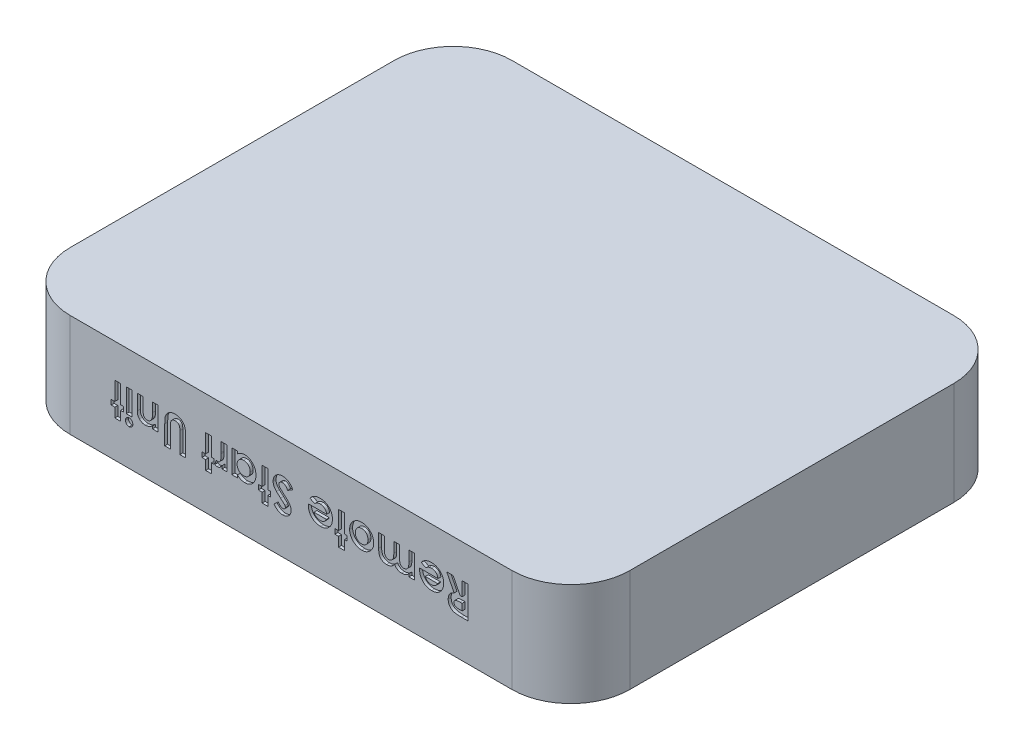
from build123d import *

# Parameters (mm, degrees)
SKETCH1_W           = 120.65
SKETCH1_H           = 95.25
SKETCH1_W_2         = 114.3
SKETCH1_H_2         = 88.9
BOSS_EXTRUDE1_DEPTH = 19.05
FILLET1_R           = 12.7
BOSS_EXTRUDE2_START = 3.175
BOSS_EXTRUDE2_DEPTH = 3.175
CUT_EXTRUDE1_DEPTH  = 113.298093817
FILLET2_R           = 6.35
SKETCH4_W           = 1.234722222
SKETCH4_H           = 5.027083333
CUT_EXTRUDE2_DEPTH  = 0.635


with BuildPart() as part:
    # Sketch1 → Boss-Extrude1 (new body)
    with BuildSketch(Plane(origin=(0, 0, 0), x_dir=(1, 0, 0), z_dir=(0, 1, 0))):
        Rectangle(SKETCH1_W, SKETCH1_H)
        Rectangle(SKETCH1_W_2, SKETCH1_H_2, mode=Mode.SUBTRACT)
    extrude(amount=BOSS_EXTRUDE1_DEPTH)

    # Fillet1
    fillet1_edges = [part.edges().sort_by_distance(p)[0] for p in [
        (57.15, 9.525, 44.45),
        (57.15, 9.525, -44.45),
        (-57.15, 9.525, -44.45),
        (-57.15, 9.525, 44.45),
        (-60.325, 9.525, -47.625),
        (60.325, 9.525, -47.625),
        (60.325, 9.525, 47.625),
        (-60.325, 9.525, 47.625),
    ]]
    fillet(fillet1_edges, radius=FILLET1_R)

    # Sketch2 → Boss-Extrude2 (add)
    with BuildSketch(Plane(origin=(0, 19.05, 0), x_dir=(1, 0, 0), z_dir=(0, 1, 0)).offset(BOSS_EXTRUDE2_START)):
        with BuildLine():
            Line((60.325, -34.925), (60.325, 34.925))
            ThreePointArc((60.325, 34.925), (56.605256121, 43.905256121), (47.625, 47.625))
            Line((47.625, 47.625), (-47.625, 47.625))
            ThreePointArc((-47.625, 47.625), (-56.605256121, 43.905256121), (-60.325, 34.925))
            Line((-60.325, 34.925), (-60.325, -34.925))
            ThreePointArc((-60.325, -34.925), (-56.605256121, -43.905256121), (-47.625, -47.625))
            Line((-47.625, -47.625), (47.625, -47.625))
            ThreePointArc((47.625, -47.625), (56.605256121, -43.905256121), (60.325, -34.925))
        make_face()
    extrude(amount=-BOSS_EXTRUDE2_DEPTH)

    # Sketch3 → Cut-Extrude1 (cut, through all)
    with BuildSketch(Plane.XY.offset(-44.45)):
        with BuildLine():
            Line((-2.54, -16.51), (-2.54, 16.51))
            ThreePointArc((-2.54, 16.51), (0, 19.05), (2.54, 16.51))
            Line((2.54, 16.51), (2.54, -16.51))
            ThreePointArc((2.54, -16.51), (0, -19.05), (-2.54, -16.51))
        make_face()
    extrude(amount=-CUT_EXTRUDE1_DEPTH, mode=Mode.SUBTRACT)

    # Fillet2
    fillet2_edges = [part.edges().sort_by_distance(p)[0] for p in [
        (-2.54, 0, -46.0375),
        (2.54, 0, -46.0375),
    ]]
    fillet(fillet2_edges, radius=FILLET2_R)

    # Sketch4 → Cut-Extrude2 (cut)
    # profile 1 of 16: a face of its own
    with BuildSketch(Plane.XY.offset(47.625)):
        Polygon((-36.777083333, 7.890951399), (-38.011805556, 7.890951399), (-38.011805556, 9.919423622), (-38.805555556, 9.919423622), (-38.805555556, 10.977756955), (-38.011805556, 10.977756955), (-38.011805556, 14.946506955), (-36.777083333, 14.946506955), (-36.777083333, 10.977756955), (-36.159722222, 10.977756955), (-36.159722222, 9.919423622), (-36.777083333, 9.919423622), align=None)
    # profile 2 of 16: a face of its own
    with BuildSketch(Plane.XY.offset(47.625)):
        with BuildLine():
            add(Edge.make_bspline(
                [(-34.922243924, 7.802756955), (-34.975479478, 7.805335871), (-35.080012618, 7.81039982), (-35.229226491, 7.860764578), (-35.36751553, 7.937242076), (-35.488259897, 8.045355514), (-35.590421274, 8.17343635), (-35.664276907, 8.319290714), (-35.71033141, 8.477998549), (-35.715904693, 8.588383751), (-35.71875, 8.644738292)],
                knots=[0, 0, 0, 0, 0.989651449, 1.943275965, 2.90597644, 3.919767043, 4.944608933, 5.944551278, 6.950639519, 8, 8, 8, 8], degree=3))
            add(Edge.make_bspline(
                [(-35.71875, 8.644738292), (-35.715725574, 8.700575394), (-35.709808354, 8.80981942), (-35.66647354, 8.967524643), (-35.590972334, 9.110202004), (-35.491345204, 9.238118722), (-35.36965345, 9.342518295), (-35.235350098, 9.422961445), (-35.086979288, 9.470053613), (-34.984118732, 9.475623321), (-34.931890191, 9.478451399)],
                knots=[0, 0, 0, 0, 1.052725588, 2.059633778, 3.055596988, 4.079986438, 5.099674807, 6.062641398, 7.01628558, 8, 8, 8, 8], degree=3))
            add(Edge.make_bspline(
                [(-34.931890191, 9.478451399), (-34.878228145, 9.475817956), (-34.772860598, 9.470647086), (-34.621436224, 9.420938698), (-34.483097542, 9.341169408), (-34.361441947, 9.231842046), (-34.260401069, 9.10199027), (-34.18325688, 8.956721384), (-34.140151313, 8.79551784), (-34.134268404, 8.684027354), (-34.13125, 8.626823795)],
                knots=[0, 0, 0, 0, 0.989280592, 1.942491504, 2.912382296, 3.922750976, 4.94514089, 5.940052451, 6.943081751, 8, 8, 8, 8], degree=3))
            add(Edge.make_bspline(
                [(-34.13125, 8.626823795), (-34.134298918, 8.571897348), (-34.140288076, 8.464002273), (-34.183655306, 8.308229261), (-34.258778314, 8.166146111), (-34.360745569, 8.041487616), (-34.47967895, 7.934434131), (-34.617065731, 7.858948386), (-34.765664781, 7.810932092), (-34.869511958, 7.805510138), (-34.922243924, 7.802756955)],
                knots=[0, 0, 0, 0, 1.038763745, 2.040501419, 3.031928819, 4.058179968, 5.07455544, 6.03952971, 7.004503979, 8, 8, 8, 8], degree=3))
        make_face()
    # profile 3 of 16: a face of its own
    with BuildSketch(Plane.XY.offset(47.625)):
        with Locations((-34.925, 12.432965289)):
            Rectangle(SKETCH4_W, SKETCH4_H)
    # profile 4 of 16: a face of its own
    with BuildSketch(Plane.XY.offset(47.625)):
        with BuildLine():
            Line((-28.663194444, 9.919423622), (-29.897916667, 9.919423622))
            Line((-29.897916667, 9.919423622), (-29.897916667, 10.451346365))
            add(Edge.make_bspline(
                [(-29.897916667, 10.451346365), (-29.968332482, 10.396512049), (-30.102910794, 10.291713011), (-30.308069843, 10.158654784), (-30.500399105, 10.047392993), (-30.686868257, 9.964781881), (-30.868872568, 9.904283409), (-31.05089184, 9.863636303), (-31.234202354, 9.835545655), (-31.35761444, 9.832667231), (-31.419270833, 9.831229177)],
                knots=[0, 0, 0, 0, 1.276368674, 2.439388659, 3.495912974, 4.452193402, 5.352134101, 6.235408687, 7.118414254, 8, 8, 8, 8], degree=3))
            add(Edge.make_bspline(
                [(-31.419270833, 9.831229177), (-31.481835848, 9.83271251), (-31.604717541, 9.83562587), (-31.784964707, 9.861735328), (-31.958252531, 9.901052718), (-32.12446902, 9.957994293), (-32.28382871, 10.031332002), (-32.435343357, 10.121402294), (-32.580451037, 10.226390446), (-32.668572717, 10.307998061), (-32.713248698, 10.349371538)],
                knots=[0, 0, 0, 0, 1.049021809, 2.060345963, 3.049166385, 4.026358373, 5.002121295, 5.98669893, 6.979295433, 8, 8, 8, 8], degree=3))
            add(Edge.make_bspline(
                [(-32.713248698, 10.349371538), (-32.749163867, 10.387579446), (-32.82125706, 10.464274896), (-32.911909938, 10.595547545), (-32.990181549, 10.738921936), (-33.052983516, 10.895859685), (-33.1010035, 11.066479423), (-33.136901712, 11.249336795), (-33.157324946, 11.445825336), (-33.159825535, 11.580831608), (-33.161111111, 11.650239594)],
                knots=[0, 0, 0, 0, 0.889614892, 1.785740703, 2.700456201, 3.659579934, 4.649837014, 5.707163549, 6.821231365, 8, 8, 8, 8], degree=3))
            Line((-33.161111111, 11.650239594), (-33.161111111, 14.946506955))
            Line((-33.161111111, 14.946506955), (-31.926388889, 14.946506955))
            Line((-31.926388889, 14.946506955), (-31.926388889, 12.763694455))
            add(Edge.make_bspline(
                [(-31.926388889, 12.763694455), (-31.926127901, 12.692494889), (-31.925627766, 12.556054135), (-31.921784269, 12.360787309), (-31.914288257, 12.18443464), (-31.907433633, 12.026680891), (-31.894062634, 11.888067879), (-31.881749254, 11.767323907), (-31.863515949, 11.66583608), (-31.839077, 11.556868374), (-31.797537214, 11.440651529), (-31.730366412, 11.319610095), (-31.650349136, 11.213527547), (-31.552132808, 11.127872097), (-31.440952022, 11.058524697), (-31.315345168, 11.013286983), (-31.179139746, 10.982440365), (-31.08413619, 10.979357811), (-31.034798177, 10.977756955)],
                knots=[0, 0, 0, 0, 1.498094087, 2.87081926, 4.108872756, 5.212198849, 6.192223846, 7.038608387, 7.76476505, 8.360237201, 9.387450647, 10.347786011, 11.264120523, 12.167881173, 13.074582735, 14.004426592, 14.963642712, 16, 16, 16, 16], degree=3))
            add(Edge.make_bspline(
                [(-31.034798177, 10.977756955), (-30.9706909, 10.981086154), (-30.844840173, 10.987621795), (-30.662991209, 11.034649389), (-30.49731074, 11.117566362), (-30.346165552, 11.228296942), (-30.213270226, 11.368121447), (-30.104591816, 11.535289915), (-30.014328508, 11.724543092), (-29.975759546, 11.862633022), (-29.955794271, 11.934115462)],
                knots=[0, 0, 0, 0, 0.983921966, 1.931563801, 2.858832989, 3.812360937, 4.795068995, 5.802394485, 6.86240651, 8, 8, 8, 8], degree=3))
            add(Edge.make_bspline(
                [(-29.955794271, 11.934115462), (-29.950832152, 11.956561153), (-29.939765631, 12.006619556), (-29.930535373, 12.091179132), (-29.918391908, 12.19203007), (-29.91092385, 12.309782408), (-29.905678541, 12.444873383), (-29.901673097, 12.596475361), (-29.898908674, 12.765522319), (-29.89825829, 12.883582563), (-29.897916667, 12.945595497)],
                knots=[0, 0, 0, 0, 0.543349587, 1.211778823, 2.009659055, 2.946304759, 4.001087888, 5.207523181, 6.533209197, 8, 8, 8, 8], degree=3))
            Line((-29.897916667, 12.945595497), (-29.897916667, 14.946506955))
            Line((-29.897916667, 14.946506955), (-28.663194444, 14.946506955))
            Line((-28.663194444, 14.946506955), (-28.663194444, 9.919423622))
        make_face()
    # profile 5 of 16: a face of its own
    with BuildSketch(Plane.XY.offset(47.625)):
        with BuildLine():
            Line((-22.754166667, 8.067340288), (-23.988888889, 8.067340288))
            Line((-23.988888889, 8.067340288), (-23.988888889, 12.543208344))
            add(Edge.make_bspline(
                [(-23.988888889, 12.543208344), (-23.988958757, 12.589611882), (-23.989093707, 12.679239838), (-23.995549065, 12.807831755), (-24.001633158, 12.926472977), (-24.01198505, 13.034201819), (-24.028222722, 13.131352695), (-24.043382874, 13.218283535), (-24.064167723, 13.294219629), (-24.095293129, 13.380713932), (-24.143886921, 13.477881009), (-24.220960969, 13.580299097), (-24.313000436, 13.671459841), (-24.421390976, 13.748002654), (-24.542405247, 13.812743446), (-24.6784281, 13.855564059), (-24.825037631, 13.884608511), (-24.9271806, 13.886963026), (-24.979698351, 13.888173622)],
                knots=[0, 0, 0, 0, 1.155195489, 2.231248153, 3.20507519, 4.113220553, 4.92363642, 5.657123012, 6.309133385, 6.880755525, 7.944644177, 8.999147208, 10.058600405, 11.156792429, 12.29246015, 13.460660758, 14.694375292, 16, 16, 16, 16], degree=3))
            add(Edge.make_bspline(
                [(-24.979698351, 13.888173622), (-25.035438054, 13.886564825), (-25.144121039, 13.883427944), (-25.300761823, 13.851972281), (-25.446294332, 13.803051509), (-25.576742348, 13.731804575), (-25.692576493, 13.647700025), (-25.788677959, 13.549497677), (-25.867824092, 13.442216248), (-25.917576789, 13.341208944), (-25.946434188, 13.249124218), (-25.965338063, 13.166140237), (-25.981453647, 13.069489372), (-25.995618568, 12.958755754), (-26.003863693, 12.833560369), (-26.013141112, 12.69445433), (-26.01648412, 12.541385779), (-26.017060531, 12.434801967), (-26.017361111, 12.379221799)],
                knots=[0, 0, 0, 0, 1.260834212, 2.45841325, 3.603280198, 4.724942815, 5.811019112, 6.833506895, 7.823953325, 8.819576102, 9.365694356, 10.006623749, 10.745436914, 11.584131356, 12.533575865, 13.586103333, 14.74122738, 16, 16, 16, 16], degree=3))
            Line((-26.017361111, 12.379221799), (-26.017361111, 8.067340288))
            Line((-26.017361111, 8.067340288), (-27.252083333, 8.067340288))
            Line((-27.252083333, 8.067340288), (-27.252083333, 12.171138031))
            add(Edge.make_bspline(
                [(-27.252083333, 12.171138031), (-27.251934062, 12.254282314), (-27.251647027, 12.414160661), (-27.246291249, 12.6438926), (-27.236480076, 12.853829678), (-27.224301306, 13.043591371), (-27.209696514, 13.213719765), (-27.190795374, 13.364128074), (-27.167673925, 13.494735643), (-27.133021321, 13.643399134), (-27.073300548, 13.814584145), (-26.976993188, 14.011697402), (-26.854736967, 14.204671063), (-26.710267646, 14.391444846), (-26.547022424, 14.564762232), (-26.369383533, 14.717425895), (-26.178313883, 14.843938155), (-25.97513108, 14.94734694), (-25.756062205, 15.026245249), (-25.521206673, 15.0817559), (-25.269719595, 15.117522206), (-25.096499593, 15.121068727), (-25.007259115, 15.122895844)],
                knots=[0, 0, 0, 0, 1.170912322, 2.251550202, 3.235884933, 4.130507595, 4.929373885, 5.640290569, 6.26461063, 6.796528574, 7.788739464, 8.810047518, 9.879767716, 11.000329969, 12.130634485, 13.227340211, 14.291294104, 15.350161901, 16.430664233, 17.561930962, 18.743941553, 20, 20, 20, 20], degree=3))
            add(Edge.make_bspline(
                [(-25.007259115, 15.122895844), (-24.947960608, 15.121894048), (-24.830965872, 15.119917526), (-24.658888807, 15.102584173), (-24.492602928, 15.076823387), (-24.332003868, 15.03999814), (-24.177704291, 14.989627171), (-24.028874001, 14.930613816), (-23.885356274, 14.861816582), (-23.750383219, 14.779823122), (-23.621139866, 14.692530535), (-23.50094127, 14.598625659), (-23.390322585, 14.499273208), (-23.289377016, 14.394318289), (-23.19810967, 14.283796192), (-23.116495495, 14.167721626), (-23.044712043, 14.046035302), (-22.9809371, 13.916562536), (-22.92635801, 13.772716717), (-22.880322612, 13.609386817), (-22.840303057, 13.424437944), (-22.810008088, 13.216651755), (-22.783306847, 12.986974313), (-22.766005539, 12.734529119), (-22.757075066, 12.460133014), (-22.75516063, 12.269903818), (-22.754166667, 12.171138031)],
                knots=[0, 0, 0, 0, 1.001274302, 1.975493657, 2.918061388, 3.842055805, 4.754744607, 5.656586832, 6.54484551, 7.438946169, 8.321187755, 9.177850665, 10.012845812, 10.830395126, 11.634995211, 12.431362049, 13.224358528, 14.018909421, 14.866105371, 15.818803578, 16.882454076, 18.059767828, 19.363726729, 20.787034531, 22.331848803, 24, 24, 24, 24], degree=3))
            Line((-22.754166667, 12.171138031), (-22.754166667, 8.067340288))
        make_face()
    # profile 6 of 16: a face of its own
    with BuildSketch(Plane.XY.offset(47.625)):
        Polygon((-17.197916667, 7.890951399), (-18.432638889, 7.890951399), (-18.432638889, 9.919423622), (-19.226388889, 9.919423622), (-19.226388889, 10.977756955), (-18.432638889, 10.977756955), (-18.432638889, 14.946506955), (-17.197916667, 14.946506955), (-17.197916667, 10.977756955), (-16.580555556, 10.977756955), (-16.580555556, 9.919423622), (-17.197916667, 9.919423622), align=None)
    # profile 7 of 16: a face of its own
    with BuildSketch(Plane.XY.offset(47.625)):
        with BuildLine():
            Line((-13.846527778, 9.919423622), (-14.904861111, 9.919423622))
            Line((-14.904861111, 9.919423622), (-14.904861111, 10.538162771))
            add(Edge.make_bspline(
                [(-14.904861111, 10.538162771), (-14.934769687, 10.4831436), (-14.993227241, 10.375606348), (-15.101333002, 10.231522634), (-15.223895664, 10.108001768), (-15.360700799, 10.00786825), (-15.507081715, 9.928252447), (-15.662157782, 9.873647578), (-15.823214973, 9.83687337), (-15.93359095, 9.833124122), (-15.98937717, 9.831229177)],
                knots=[0, 0, 0, 0, 1.098409642, 2.146887215, 3.15060926, 4.142663133, 5.113340811, 6.064933309, 7.021978713, 8, 8, 8, 8], degree=3))
            add(Edge.make_bspline(
                [(-15.98937717, 9.831229177), (-16.029913549, 9.832953225), (-16.112542964, 9.836467528), (-16.237620613, 9.861693943), (-16.365859133, 9.899487567), (-16.449542232, 9.936377046), (-16.492361111, 9.955252615)],
                knots=[0, 0, 0, 0, 0.931681262, 1.899140464, 2.92503444, 4, 4, 4, 4], degree=3))
            Line((-16.492361111, 9.955252615), (-16.109266493, 11.001183604))
            add(Edge.make_bspline(
                [(-16.109266493, 11.001183604), (-16.075023305, 10.984638951), (-16.010659293, 10.953541373), (-15.917213923, 10.916843026), (-15.832408376, 10.894451489), (-15.778643216, 10.891110475), (-15.753732639, 10.889562511)],
                knots=[0, 0, 0, 0, 1.214386998, 2.282580073, 3.20428172, 4, 4, 4, 4], degree=3))
            add(Edge.make_bspline(
                [(-15.753732639, 10.889562511), (-15.730206356, 10.890579583), (-15.683926105, 10.892580339), (-15.615720062, 10.909999324), (-15.550841202, 10.939419551), (-15.488809047, 10.979622425), (-15.429772221, 11.030804124), (-15.372919072, 11.092637144), (-15.322085785, 11.168364972), (-15.268625558, 11.252900131), (-15.22309107, 11.356295048), (-15.183899611, 11.47972659), (-15.149717344, 11.624808071), (-15.122903132, 11.791545904), (-15.102854508, 11.979727314), (-15.08810963, 12.189324637), (-15.078136908, 12.420467338), (-15.077465697, 12.581782018), (-15.077115885, 12.665853743)],
                knots=[0, 0, 0, 0, 0.544259334, 1.070651881, 1.618331981, 2.187895439, 2.776420197, 3.424094598, 4.12659612, 4.885633066, 5.737955424, 6.733832302, 7.882163033, 9.186958323, 10.642647142, 12.264016219, 14.052932313, 16, 16, 16, 16], degree=3))
            Line((-15.077115885, 12.665853743), (-15.08125, 12.911144542))
            Line((-15.08125, 12.911144542), (-15.08125, 14.946506955))
            Line((-15.08125, 14.946506955), (-13.846527778, 14.946506955))
            Line((-13.846527778, 14.946506955), (-13.846527778, 9.919423622))
        make_face()
    # profile 8 of 16: a face of its own
    with BuildSketch(Plane.XY.offset(47.625)):
        with BuildLine():
            Line((-11.553472222, 9.919423622), (-12.788194444, 9.919423622))
            Line((-12.788194444, 9.919423622), (-12.788194444, 14.946506955))
            Line((-12.788194444, 14.946506955), (-11.553472222, 14.946506955))
            Line((-11.553472222, 14.946506955), (-11.553472222, 14.398047754))
            add(Edge.make_bspline(
                [(-11.553472222, 14.398047754), (-11.492184387, 14.451275459), (-11.373033721, 14.554756297), (-11.18736334, 14.691363058), (-10.99861241, 14.799618175), (-10.81052601, 14.889472107), (-10.616614446, 14.953570466), (-10.4171267, 15.001208418), (-10.209286645, 15.028967769), (-10.068027819, 15.032770281), (-9.996289063, 15.034701399)],
                knots=[0, 0, 0, 0, 1.129087683, 2.195077524, 3.200104641, 4.152071996, 5.089690739, 6.035159067, 7.002149119, 8, 8, 8, 8], degree=3))
            add(Edge.make_bspline(
                [(-9.996289063, 15.034701399), (-9.915756028, 15.032890287), (-9.756618188, 15.029311426), (-9.523108129, 14.991616297), (-9.29760351, 14.933962378), (-9.080418159, 14.852203906), (-8.87123391, 14.74677951), (-8.671129448, 14.617990936), (-8.479200555, 14.466106277), (-8.298406949, 14.292665085), (-8.131108677, 14.102882624), (-7.984061208, 13.899785468), (-7.860486632, 13.684447738), (-7.760078117, 13.457951792), (-7.6807671, 13.220391225), (-7.624280123, 12.971223902), (-7.590940566, 12.71040268), (-7.586815081, 12.53273988), (-7.584722222, 12.442611556)],
                knots=[0, 0, 0, 0, 0.980635182, 1.937790695, 2.874612845, 3.813473129, 4.759763495, 5.72404569, 6.708444218, 7.737858197, 8.773145527, 9.787642451, 10.788159158, 11.793035368, 12.802034882, 13.835443946, 14.901920881, 16, 16, 16, 16], degree=3))
            add(Edge.make_bspline(
                [(-7.584722222, 12.442611556), (-7.586916469, 12.349282515), (-7.59122073, 12.166207204), (-7.622777326, 11.897573011), (-7.678107909, 11.642174387), (-7.75431332, 11.399607518), (-7.850077514, 11.169155522), (-7.97160642, 10.953578233), (-8.112600143, 10.749570927), (-8.274083355, 10.561015703), (-8.451270771, 10.391332833), (-8.638173422, 10.240698874), (-8.835093324, 10.113473507), (-9.042524481, 10.010837046), (-9.25828328, 9.930741928), (-9.483426741, 9.872268338), (-9.718188691, 9.837125845), (-9.878117392, 9.833211057), (-9.959082031, 9.831229177)],
                knots=[0, 0, 0, 0, 1.136340375, 2.229058262, 3.287747549, 4.313796199, 5.321476843, 6.32056726, 7.321347234, 8.336944959, 9.337787455, 10.30479778, 11.255888616, 12.186428358, 13.117354666, 14.053442213, 15.014546185, 16, 16, 16, 16], degree=3))
            add(Edge.make_bspline(
                [(-9.959082031, 9.831229177), (-10.034089823, 9.832748012), (-10.182503206, 9.835753239), (-10.400389262, 9.869781235), (-10.61230866, 9.918260247), (-10.816303225, 9.990518939), (-11.013359599, 10.083488627), (-11.202071131, 10.197229167), (-11.384965444, 10.32975815), (-11.496609317, 10.433141631), (-11.553472222, 10.48579732)],
                knots=[0, 0, 0, 0, 1.016860689, 2.012000776, 2.985574089, 3.963288254, 4.94189597, 5.937036056, 6.949282938, 8, 8, 8, 8], degree=3))
            Line((-11.553472222, 10.48579732), (-11.553472222, 9.919423622))
        make_face()
        with BuildLine():
            add(Edge.make_bspline(
                [(-10.218153212, 10.977756955), (-10.168953565, 10.97926724), (-10.072525471, 10.982227299), (-9.930708044, 11.000015205), (-9.795198923, 11.031408803), (-9.666843892, 11.077611809), (-9.54438809, 11.134400223), (-9.427805634, 11.203210526), (-9.318770097, 11.287080734), (-9.216193254, 11.381398732), (-9.122045811, 11.485199753), (-9.042882096, 11.599368197), (-8.972594314, 11.718416044), (-8.915897812, 11.845458066), (-8.873925741, 11.980341606), (-8.841174452, 12.121568703), (-8.824097448, 12.270400526), (-8.821010965, 12.371836165), (-8.819444444, 12.423319021)],
                knots=[0, 0, 0, 0, 1.048146026, 2.054297773, 3.039291333, 4.004895774, 4.954855183, 5.911393651, 6.882091317, 7.879305688, 8.877191939, 9.859995919, 10.833402353, 11.818978979, 12.815424932, 13.838562528, 14.902979527, 16, 16, 16, 16], degree=3))
            add(Edge.make_bspline(
                [(-8.819444444, 12.423319021), (-8.820987699, 12.475268647), (-8.824028666, 12.577634783), (-8.841442284, 12.72772502), (-8.873046874, 12.871004211), (-8.919493924, 13.006080119), (-8.974979895, 13.135474225), (-9.04699392, 13.255952017), (-9.129079058, 13.370652489), (-9.224343625, 13.476368945), (-9.328296232, 13.571532815), (-9.437939214, 13.657472145), (-9.55476628, 13.728478543), (-9.67754356, 13.787196635), (-9.805444295, 13.832688914), (-9.939913894, 13.864485758), (-10.079777461, 13.88397363), (-10.175371537, 13.886763957), (-10.223665365, 13.888173622)],
                knots=[0, 0, 0, 0, 1.099575806, 2.166701374, 3.192649988, 4.197894673, 5.185929295, 6.166282287, 7.161891816, 8.166995477, 9.171440763, 10.141716722, 11.110384286, 12.058293159, 13.017598555, 13.97724868, 14.978112372, 16, 16, 16, 16], degree=3))
            add(Edge.make_bspline(
                [(-10.223665365, 13.888173622), (-10.273782179, 13.886656167), (-10.37203838, 13.883681132), (-10.516158658, 13.866037359), (-10.653527626, 13.834595533), (-10.783463114, 13.787884809), (-10.908571525, 13.73219881), (-11.025971602, 13.661104066), (-11.13676557, 13.577536318), (-11.240927322, 13.483713635), (-11.334477335, 13.378363478), (-11.41801021, 13.265669893), (-11.487002434, 13.143155703), (-11.543507285, 13.013307218), (-11.587814425, 12.875771549), (-11.619767124, 12.730495785), (-11.637109864, 12.577160251), (-11.640128528, 12.472509142), (-11.641666667, 12.419184906)],
                knots=[0, 0, 0, 0, 1.050055163, 2.05867895, 3.036770115, 3.995495956, 4.947241397, 5.901173699, 6.863515112, 7.851357518, 8.832757047, 9.810564118, 10.784575339, 11.771479801, 12.772731182, 13.807147486, 14.882647436, 16, 16, 16, 16], degree=3))
            add(Edge.make_bspline(
                [(-11.641666667, 12.419184906), (-11.640149062, 12.366777219), (-11.637184738, 12.264409782), (-11.619676362, 12.1142843), (-11.587569777, 11.971830562), (-11.543788599, 11.836406151), (-11.487002629, 11.708903485), (-11.417580823, 11.588984489), (-11.334507947, 11.47784486), (-11.240820787, 11.373988953), (-11.137145039, 11.281395702), (-11.025323795, 11.200233311), (-10.90700832, 11.13175712), (-10.782368292, 11.074096746), (-10.650118721, 11.032251109), (-10.512547459, 10.999766365), (-10.367427259, 10.982237329), (-10.268723222, 10.979274784), (-10.218153212, 10.977756955)],
                knots=[0, 0, 0, 0, 1.106253802, 2.160835036, 3.183977744, 4.183421548, 5.159890935, 6.124302589, 7.101541683, 8.083003376, 9.071668641, 10.029626693, 10.994038348, 11.952829982, 12.921617172, 13.916395167, 14.932486243, 16, 16, 16, 16], degree=3))
        make_face(mode=Mode.SUBTRACT)
    # profile 9 of 16: a face of its own
    with BuildSketch(Plane.XY.offset(47.625)):
        Polygon((-5.027083333, 7.890951399), (-6.261805556, 7.890951399), (-6.261805556, 9.919423622), (-7.055555556, 9.919423622), (-7.055555556, 10.977756955), (-6.261805556, 10.977756955), (-6.261805556, 14.946506955), (-5.027083333, 14.946506955), (-5.027083333, 10.977756955), (-4.409722222, 10.977756955), (-4.409722222, 9.919423622), (-5.027083333, 9.919423622), align=None)
    # profile 10 of 16: a face of its own
    with BuildSketch(Plane.XY.offset(47.625)):
        with BuildLine():
            Line((-3.704166667, 8.986491764), (-2.780881076, 9.831229177))
            add(Edge.make_bspline(
                [(-2.780881076, 9.831229177), (-2.741339091, 9.775430394), (-2.665423993, 9.668304512), (-2.542249849, 9.525017023), (-2.419811582, 9.40198025), (-2.295605819, 9.302711956), (-2.171770992, 9.222797852), (-2.045676164, 9.167677873), (-1.91877197, 9.132229884), (-1.833467163, 9.127837247), (-1.791449653, 9.125673622)],
                knots=[0, 0, 0, 0, 1.299459705, 2.494781419, 3.587730629, 4.594196874, 5.512431013, 6.380462003, 7.202284646, 8, 8, 8, 8], degree=3))
            add(Edge.make_bspline(
                [(-1.791449653, 9.125673622), (-1.752240871, 9.127007129), (-1.676539015, 9.12958178), (-1.56912308, 9.156461443), (-1.472591716, 9.199897531), (-1.389516257, 9.259897556), (-1.322683857, 9.331554997), (-1.270717675, 9.407837841), (-1.240520025, 9.491011258), (-1.23664205, 9.548053044), (-1.234722222, 9.576292111)],
                knots=[0, 0, 0, 0, 1.184157716, 2.286297433, 3.324836695, 4.370048774, 5.362957217, 6.276446515, 7.146738784, 8, 8, 8, 8], degree=3))
            add(Edge.make_bspline(
                [(-1.234722222, 9.576292111), (-1.23593747, 9.604925144), (-1.238384812, 9.662588093), (-1.262022796, 9.747100325), (-1.297651987, 9.829678614), (-1.331697134, 9.879947949), (-1.349099392, 9.90564324)],
                knots=[0, 0, 0, 0, 0.967525499, 1.948461899, 2.951351359, 4, 4, 4, 4], degree=3))
            add(Edge.make_bspline(
                [(-1.349099392, 9.90564324), (-1.364983726, 9.925556502), (-1.401758634, 9.971659059), (-1.469749776, 10.045844459), (-1.558652285, 10.132933993), (-1.664708613, 10.237315856), (-1.791898852, 10.354935484), (-1.937492171, 10.489198421), (-2.104727853, 10.635543854), (-2.221893518, 10.738857058), (-2.283409288, 10.793099837)],
                knots=[0, 0, 0, 0, 0.473849886, 1.097042329, 1.870584189, 2.789244661, 3.865562256, 5.093556389, 6.47402294, 8, 8, 8, 8], degree=3))
            add(Edge.make_bspline(
                [(-2.283409288, 10.793099837), (-2.341289047, 10.843166243), (-2.451132804, 10.938181881), (-2.607220582, 11.073263096), (-2.745288875, 11.194246928), (-2.864082008, 11.302039342), (-2.967149799, 11.392201309), (-3.049933798, 11.470279715), (-3.115976988, 11.532858971), (-3.15348178, 11.570700191), (-3.169487847, 11.586849837)],
                knots=[0, 0, 0, 0, 1.543627419, 2.929484142, 4.163674036, 5.24627963, 6.164986907, 6.925413438, 7.541394495, 8, 8, 8, 8], degree=3))
            add(Edge.make_bspline(
                [(-3.169487847, 11.586849837), (-3.230248971, 11.65255477), (-3.34705319, 11.778862726), (-3.498559926, 11.975130215), (-3.624598882, 12.165246106), (-3.72220315, 12.354578959), (-3.792990082, 12.547041518), (-3.844520459, 12.745379746), (-3.875407946, 12.952429486), (-3.878826487, 13.093401249), (-3.880555556, 13.16470357)],
                knots=[0, 0, 0, 0, 1.206413378, 2.319150186, 3.339784753, 4.27899982, 5.184598145, 6.099639703, 7.038813909, 8, 8, 8, 8], degree=3))
            add(Edge.make_bspline(
                [(-3.880555556, 13.16470357), (-3.879323335, 13.234179507), (-3.876905672, 13.370493882), (-3.847326009, 13.569978921), (-3.805086853, 13.760859353), (-3.740001294, 13.941222939), (-3.660006016, 14.113207136), (-3.562511063, 14.276869778), (-3.44331374, 14.428389997), (-3.310920258, 14.571856226), (-3.162190145, 14.700632121), (-3.002257384, 14.814164687), (-2.830817399, 14.910023077), (-2.649176688, 14.989020269), (-2.455057183, 15.047644907), (-2.251525504, 15.091968548), (-2.03653099, 15.11869361), (-1.889825743, 15.121474917), (-1.814876302, 15.122895844)],
                knots=[0, 0, 0, 0, 1.043039441, 2.046482205, 3.024244422, 3.976033659, 4.920890471, 5.871402525, 6.830893638, 7.812473116, 8.800703348, 9.781190227, 10.754606487, 11.746997808, 12.751247331, 13.796362838, 14.874195872, 16, 16, 16, 16], degree=3))
            add(Edge.make_bspline(
                [(-1.814876302, 15.122895844), (-1.756040765, 15.1218532), (-1.639512659, 15.119788168), (-1.46777596, 15.102894268), (-1.301913686, 15.075715244), (-1.142257114, 15.036459497), (-0.987796319, 14.987854251), (-0.840207542, 14.924650062), (-0.697528501, 14.85317448), (-0.560233683, 14.770345856), (-0.429460781, 14.674148449), (-0.301441985, 14.56837911), (-0.180715689, 14.447236845), (-0.062669269, 14.315137938), (0.047767073, 14.168253846), (0.156412737, 14.011004448), (0.257965041, 13.8396306), (0.320722606, 13.719434661), (0.352777778, 13.658041243)],
                knots=[0, 0, 0, 0, 1.017088714, 2.014418954, 2.980620591, 3.920647918, 4.854987948, 5.776890852, 6.693269322, 7.612671471, 8.545186947, 9.498010697, 10.480815007, 11.499174288, 12.558697099, 13.655746277, 14.802607237, 16, 16, 16, 16], degree=3))
            Line((0.352777778, 13.658041243), (-0.733116319, 13.006229177))
            add(Edge.make_bspline(
                [(-0.733116319, 13.006229177), (-0.773209696, 13.075921059), (-0.850072126, 13.209526353), (-0.980322698, 13.389041999), (-1.11375776, 13.542767434), (-1.253462211, 13.667985552), (-1.397737297, 13.766370679), (-1.547279899, 13.836683517), (-1.702195084, 13.880207084), (-1.807716271, 13.885522317), (-1.860351563, 13.888173622)],
                knots=[0, 0, 0, 0, 1.283663364, 2.460892379, 3.537111102, 4.529833553, 5.449777664, 6.316464042, 7.160231139, 8, 8, 8, 8], degree=3))
            add(Edge.make_bspline(
                [(-1.860351563, 13.888173622), (-1.913899049, 13.886028997), (-2.017788973, 13.881868113), (-2.166322664, 13.842676803), (-2.303100809, 13.782523312), (-2.420695278, 13.695039308), (-2.520555589, 13.595282097), (-2.592145169, 13.482771672), (-2.638582828, 13.362499422), (-2.643407034, 13.278572159), (-2.645833333, 13.236361556)],
                knots=[0, 0, 0, 0, 1.13537643, 2.202795631, 3.242191317, 4.290390765, 5.297919085, 6.223733717, 7.106639842, 8, 8, 8, 8], degree=3))
            add(Edge.make_bspline(
                [(-2.645833333, 13.236361556), (-2.643562248, 13.197111167), (-2.638948755, 13.117377761), (-2.605152129, 12.998758182), (-2.551874339, 12.880713786), (-2.490731816, 12.782865834), (-2.426987444, 12.701305497), (-2.364505748, 12.631699754), (-2.290454131, 12.553188605), (-2.202945717, 12.467912964), (-2.103682531, 12.374233251), (-1.992339605, 12.272372198), (-1.86771788, 12.163160123), (-1.77963146, 12.088768976), (-1.733572049, 12.04987067)],
                knots=[0, 0, 0, 0, 0.916057066, 1.860882232, 2.859899639, 3.934694552, 4.546382938, 5.276161949, 6.118633209, 7.067046139, 8.129668089, 9.306861125, 10.591787583, 12, 12, 12, 12], degree=3))
            add(Edge.make_bspline(
                [(-1.733572049, 12.04987067), (-1.646014553, 11.97578377), (-1.477965218, 11.833588584), (-1.240447782, 11.623612353), (-1.026572308, 11.427224182), (-0.837765184, 11.242852943), (-0.673465558, 11.071676658), (-0.531864722, 10.915198085), (-0.415250872, 10.770348704), (-0.294329464, 10.597343267), (-0.176185704, 10.3894977), (-0.075780323, 10.138260719), (-0.01088999, 9.887338301), (-0.003592012, 9.718599672), (0, 9.635547754)],
                knots=[0, 0, 0, 0, 1.345685333, 2.582777463, 3.719355561, 4.752181389, 5.678433858, 6.502864483, 7.227563063, 7.858499643, 8.978226409, 10.023061349, 11.026965269, 12, 12, 12, 12], degree=3))
            add(Edge.make_bspline(
                [(0, 9.635547754), (-0.001494614, 9.576653178), (-0.004439163, 9.460624537), (-0.030627225, 9.290001321), (-0.069948302, 9.125442066), (-0.126455122, 8.966988412), (-0.202246244, 8.816425417), (-0.291769443, 8.671316187), (-0.397573863, 8.532104246), (-0.518836967, 8.401877724), (-0.651950477, 8.282166801), (-0.79392898, 8.177139421), (-0.943460714, 8.0883286), (-1.100999133, 8.015978224), (-1.266265469, 7.959519674), (-1.43941237, 7.919619502), (-1.619909227, 7.895825461), (-1.742686817, 7.892596328), (-1.805230035, 7.890951399)],
                knots=[0, 0, 0, 0, 1.010806554, 1.991397492, 2.957573065, 3.913225829, 4.872777376, 5.846906201, 6.837692339, 7.870332167, 8.898170327, 9.907899016, 10.8981826, 11.879407896, 12.8797257, 13.891947133, 14.926152479, 16, 16, 16, 16], degree=3))
            add(Edge.make_bspline(
                [(-1.805230035, 7.890951399), (-1.886278148, 7.893924386), (-2.047734611, 7.899846893), (-2.2865233, 7.945917411), (-2.519876945, 8.01913252), (-2.708500007, 8.105376628), (-2.857292661, 8.191584795), (-2.971605543, 8.269344047), (-3.088832181, 8.358638349), (-3.206820494, 8.462066233), (-3.330044632, 8.573648917), (-3.452280454, 8.701043919), (-3.579513689, 8.837723883), (-3.661887765, 8.936033743), (-3.704166667, 8.986491764)],
                knots=[0, 0, 0, 0, 1.282890948, 2.555655204, 3.837225328, 5.149160694, 5.83044799, 6.558852598, 7.337307105, 8.162686284, 9.043076448, 9.969084596, 10.957622644, 12, 12, 12, 12], degree=3))
        make_face()
    # profile 11 of 16: a face of its own
    with BuildSketch(Plane.XY.offset(47.625)):
        with BuildLine():
            Line((3.708300781, 12.741645844), (7.672916667, 12.741645844))
            add(Edge.make_bspline(
                [(7.672916667, 12.741645844), (7.664812795, 12.787704884), (7.648888048, 12.878214532), (7.614791767, 13.009397169), (7.569785564, 13.132931939), (7.518023637, 13.249833603), (7.457454439, 13.359688479), (7.385934098, 13.461031597), (7.306579017, 13.555948502), (7.217885868, 13.64305107), (7.122126919, 13.721327758), (7.019041078, 13.789378083), (6.910307446, 13.847466506), (6.794684484, 13.894349846), (6.673099701, 13.931956424), (6.54474694, 13.957758837), (6.410085568, 13.973033936), (6.318345522, 13.975240277), (6.271451823, 13.976368066)],
                knots=[0, 0, 0, 0, 1.091578896, 2.145038655, 3.15928737, 4.157766048, 5.127497078, 6.082469626, 7.049112333, 8.012179284, 8.980248595, 9.932024523, 10.891502393, 11.853374471, 12.840501167, 13.858428296, 14.905317556, 16, 16, 16, 16], degree=3))
            add(Edge.make_bspline(
                [(6.271451823, 13.976368066), (6.214848427, 13.974873682), (6.103379672, 13.971930799), (5.940077116, 13.945831799), (5.782139756, 13.906410407), (5.631062237, 13.847787489), (5.485094562, 13.77481226), (5.346639807, 13.683894105), (5.213301431, 13.577689948), (5.131949308, 13.495827824), (5.09047309, 13.45409159)],
                knots=[0, 0, 0, 0, 1.021034703, 2.010718019, 2.977989445, 3.954245119, 4.929443971, 5.918328161, 6.938689359, 8, 8, 8, 8], degree=3))
            Line((5.09047309, 13.45409159), (4.056944444, 13.946051226))
            add(Edge.make_bspline(
                [(4.056944444, 13.946051226), (4.089997426, 13.990980725), (4.155330717, 14.079789417), (4.260592819, 14.205059972), (4.36907229, 14.322898411), (4.483767588, 14.430624686), (4.603679077, 14.528443838), (4.728297156, 14.616793232), (4.85694919, 14.697184066), (4.99056263, 14.769340112), (5.131137505, 14.830952133), (5.276491198, 14.886775519), (5.42938143, 14.931409955), (5.58768246, 14.970950102), (5.753154231, 14.999037228), (5.924674247, 15.019803236), (6.102682232, 15.03241936), (6.22365945, 15.033931685), (6.285232205, 15.034701399)],
                knots=[0, 0, 0, 0, 1.033499484, 2.042839079, 3.030732955, 4.00037446, 4.956353854, 5.896509365, 6.829584737, 7.766535667, 8.707846775, 9.672354793, 10.650035223, 11.657650065, 12.694754689, 13.758082582, 14.858950201, 16, 16, 16, 16], degree=3))
            add(Edge.make_bspline(
                [(6.285232205, 15.034701399), (6.379962703, 15.032770129), (6.565486922, 15.028987848), (6.836849638, 14.993882873), (7.094568927, 14.935675027), (7.339372618, 14.856550443), (7.570202077, 14.752081049), (7.787173121, 14.624306878), (7.992447677, 14.475675063), (8.179775662, 14.303075911), (8.350372571, 14.115183044), (8.500448649, 13.913504751), (8.625275161, 13.698798374), (8.730844776, 13.474556496), (8.808237325, 13.236606956), (8.86665401, 12.988332045), (8.901832933, 12.727952923), (8.905681928, 12.550665213), (8.907638889, 12.460526052)],
                knots=[0, 0, 0, 0, 1.103528868, 2.161197684, 3.181904866, 4.17893931, 5.15400521, 6.128071465, 7.108807125, 8.101535823, 9.090664498, 10.062772592, 11.024896103, 11.980490186, 12.945349712, 13.934753549, 14.949957771, 16, 16, 16, 16], degree=3))
            add(Edge.make_bspline(
                [(8.907638889, 12.460526052), (8.905677605, 12.368090713), (8.901818866, 12.186228333), (8.866791593, 11.919916975), (8.808647345, 11.665793963), (8.728229881, 11.423630792), (8.627170008, 11.192012946), (8.498243914, 10.974853054), (8.349215406, 10.768747192), (8.179048806, 10.576521874), (7.990969293, 10.402947007), (7.791107218, 10.248202718), (7.577457017, 10.119752327), (7.352761642, 10.014862421), (7.117370181, 9.930648113), (6.868859335, 9.874270552), (6.609314271, 9.83648457), (6.431902563, 9.833000156), (6.341731771, 9.831229177)],
                knots=[0, 0, 0, 0, 1.079354094, 2.123580709, 3.131027717, 4.120248802, 5.100347326, 6.076737579, 7.064152558, 8.067633759, 9.069995403, 10.049814825, 11.015114092, 11.975254693, 12.94256508, 13.929104949, 14.947452504, 16, 16, 16, 16], degree=3))
            add(Edge.make_bspline(
                [(6.341731771, 9.831229177), (6.246544944, 9.833185151), (6.05965542, 9.837025503), (5.786438142, 9.871919719), (5.526880261, 9.930215204), (5.280405566, 10.009688307), (5.047484682, 10.113520977), (4.828938202, 10.241192405), (4.62349133, 10.390767309), (4.433979711, 10.562936326), (4.262484584, 10.753446932), (4.111679833, 10.960212593), (3.986799822, 11.183400517), (3.882520438, 11.419878587), (3.802760512, 11.671373077), (3.744932051, 11.936999895), (3.70983845, 12.217967694), (3.706085989, 12.410354645), (3.704166667, 12.508757389)],
                knots=[0, 0, 0, 0, 1.079725433, 2.119929612, 3.118887298, 4.094664154, 5.053604992, 6.006563715, 6.961515899, 7.932002515, 8.906358438, 9.865525889, 10.829453997, 11.80269401, 12.793349889, 13.817750914, 14.883815678, 16, 16, 16, 16], degree=3))
            Line((3.704166667, 12.508757389), (3.708300781, 12.741645844))
        make_face()
        with BuildLine():
            add(Edge.make_bspline(
                [(4.938888889, 11.771506955), (4.961956312, 11.708473762), (5.007768675, 11.583288586), (5.115762113, 11.413189569), (5.251274828, 11.261123799), (5.413793956, 11.129800754), (5.597685917, 11.021611369), (5.800363352, 10.946645122), (6.015988606, 10.897237547), (6.1650617, 10.89215578), (6.241134983, 10.889562511)],
                knots=[0, 0, 0, 0, 0.954548419, 1.89575218, 2.851198576, 3.847292229, 4.862571986, 5.878062886, 6.917157232, 8, 8, 8, 8], degree=3))
            add(Edge.make_bspline(
                [(6.241134983, 10.889562511), (6.32410132, 10.893028733), (6.486152674, 10.899799021), (6.721164174, 10.952252683), (6.94070235, 11.038418908), (7.071483133, 11.122925644), (7.136859809, 11.165170149)],
                knots=[0, 0, 0, 0, 1.045043327, 2.041197553, 3.020804202, 4, 4, 4, 4], degree=3))
            add(Edge.make_bspline(
                [(7.136859809, 11.165170149), (7.177642965, 11.197854214), (7.264865456, 11.267755267), (7.376179497, 11.408111827), (7.488648923, 11.575654538), (7.551378228, 11.703532794), (7.584722222, 11.771506955)],
                knots=[0, 0, 0, 0, 0.821695496, 1.757351177, 2.807911704, 4, 4, 4, 4], degree=3))
            Line((7.584722222, 11.771506955), (4.938888889, 11.771506955))
        make_face(mode=Mode.SUBTRACT)
    # profile 12 of 16: a face of its own
    with BuildSketch(Plane.XY.offset(47.625)):
        Polygon((11.465277778, 7.890951399), (10.230555556, 7.890951399), (10.230555556, 9.919423622), (9.436805556, 9.919423622), (9.436805556, 10.977756955), (10.230555556, 10.977756955), (10.230555556, 14.946506955), (11.465277778, 14.946506955), (11.465277778, 10.977756955), (12.082638889, 10.977756955), (12.082638889, 9.919423622), (11.465277778, 9.919423622), align=None)
    # profile 13 of 16: a face of its own
    with BuildSketch(Plane.XY.offset(47.625)):
        with BuildLine():
            add(Edge.make_bspline(
                [(15.243858507, 9.831229177), (15.1854796, 9.832253257), (15.069862913, 9.834281399), (14.897730009, 9.851622765), (14.728253338, 9.878764433), (14.561462291, 9.918076256), (14.396526965, 9.965422208), (14.235688096, 10.027256902), (14.076097107, 10.096811097), (13.921836488, 10.179952926), (13.771745969, 10.270111433), (13.629547135, 10.369101629), (13.496801257, 10.477752479), (13.371387981, 10.592616409), (13.255702976, 10.716630297), (13.145376019, 10.845632019), (13.047166389, 10.985526659), (12.956022395, 11.131094163), (12.875152702, 11.282168619), (12.804277069, 11.437112888), (12.745343264, 11.595222807), (12.697021979, 11.756414125), (12.65757778, 11.919974594), (12.632553236, 12.087418466), (12.61480124, 12.257115244), (12.612808072, 12.371365849), (12.611805556, 12.428831174)],
                knots=[0, 0, 0, 0, 1.022244532, 2.024507376, 3.027060782, 4.026251424, 5.024178108, 6.029825623, 7.041920794, 8.071232344, 9.096385297, 10.107424718, 11.10255854, 12.098894902, 13.083468502, 14.071323586, 15.06921784, 16.07380283, 17.078033395, 18.068113675, 19.055870472, 20.030666142, 21.014187355, 21.99958235, 22.993837725, 24, 24, 24, 24], degree=3))
            add(Edge.make_bspline(
                [(12.611805556, 12.428831174), (12.612864089, 12.486745295), (12.614968694, 12.601891696), (12.631903745, 12.773186906), (12.660023721, 12.941409762), (12.695980753, 13.10726236), (12.747418614, 13.268961125), (12.805098803, 13.429229379), (12.878575319, 13.585062482), (12.958741855, 13.738895545), (13.048982158, 13.88700597), (13.149135642, 14.02692138), (13.256472222, 14.158898394), (13.370626028, 14.283651983), (13.494065073, 14.398331565), (13.625695444, 14.504558457), (13.764207179, 14.603765969), (13.910642529, 14.693590316), (14.0631134, 14.772517662), (14.219051771, 14.843676587), (14.379368576, 14.902921602), (14.543732272, 14.951234246), (14.712242474, 14.988641527), (14.884527174, 15.014052735), (15.060215329, 15.031725938), (15.17858709, 15.033703194), (15.238346354, 15.034701399)],
                knots=[0, 0, 0, 0, 1.012065869, 2.012216375, 3.004733514, 3.992205109, 4.97496602, 5.968164778, 6.966799732, 7.983091762, 8.999225232, 9.995016355, 10.988052865, 11.970944933, 12.947950481, 13.92969433, 14.925485454, 15.92373309, 16.929186062, 17.924491632, 18.917690389, 19.913513875, 20.91665649, 21.931711093, 22.955836906, 24, 24, 24, 24], degree=3))
            add(Edge.make_bspline(
                [(15.238346354, 15.034701399), (15.325725201, 15.032133786), (15.497950239, 15.027072981), (15.751620891, 14.992486682), (15.995222137, 14.932734354), (16.229775747, 14.850138222), (16.45317988, 14.741754722), (16.667608249, 14.611090426), (16.871578399, 14.456356186), (17.062882477, 14.279456656), (17.237829667, 14.086512074), (17.393908493, 13.882546875), (17.523530878, 13.666198451), (17.630776782, 13.440231023), (17.713361283, 13.203601031), (17.773049531, 12.957231706), (17.807715264, 12.700372227), (17.812728225, 12.525856656), (17.815277778, 12.437099403)],
                knots=[0, 0, 0, 0, 1.030165828, 2.030472531, 3.01169893, 3.982950264, 4.956720005, 5.933857537, 6.939049165, 7.970068816, 9.001429798, 10.006621426, 10.993020566, 11.969347283, 12.950812794, 13.942564739, 14.953604529, 16, 16, 16, 16], degree=3))
            add(Edge.make_bspline(
                [(17.815277778, 12.437099403), (17.812639573, 12.342325915), (17.807454235, 12.156050521), (17.766280369, 11.883152824), (17.700530146, 11.621866212), (17.606149844, 11.372921587), (17.485587307, 11.135859804), (17.338407774, 10.911180852), (17.163883873, 10.69883384), (17.030233512, 10.570399088), (16.962272135, 10.505089854)],
                knots=[0, 0, 0, 0, 1.043912699, 2.05178951, 3.033892, 4.007821512, 4.978932272, 5.95884105, 6.962068106, 8, 8, 8, 8], degree=3))
            add(Edge.make_bspline(
                [(16.962272135, 10.505089854), (16.899910779, 10.450955846), (16.776884732, 10.344160654), (16.577007897, 10.208708461), (16.372356573, 10.091719091), (16.160477924, 9.995532069), (15.940781289, 9.923008607), (15.714392487, 9.870218015), (15.481358593, 9.837792487), (15.323427518, 9.833428065), (15.243858507, 9.831229177)],
                knots=[0, 0, 0, 0, 1.048115528, 2.067714963, 3.060638214, 4.039924844, 5.017819947, 5.994373833, 6.98952318, 8, 8, 8, 8], degree=3))
        make_face()
        with BuildLine():
            add(Edge.make_bspline(
                [(15.216297743, 10.977756955), (15.264118577, 10.979289698), (15.358254403, 10.982306918), (15.496444277, 10.99987995), (15.628329913, 11.031359623), (15.752785553, 11.078022107), (15.872643823, 11.134158786), (15.985652331, 11.204860488), (16.092232144, 11.288529084), (16.19288703, 11.382717995), (16.28220393, 11.488781634), (16.36407551, 11.600191632), (16.429450796, 11.721515017), (16.485255363, 11.84843112), (16.528066095, 11.98288159), (16.557785499, 12.124651549), (16.578246011, 12.272977991), (16.579778385, 12.374557333), (16.580555556, 12.426075097)],
                knots=[0, 0, 0, 0, 1.030671699, 2.028888332, 2.996449204, 3.945347801, 4.88844585, 5.84434065, 6.810634782, 7.804966428, 8.808860354, 9.795028423, 10.778609687, 11.771659405, 12.779693118, 13.812596584, 14.890619575, 16, 16, 16, 16], degree=3))
            add(Edge.make_bspline(
                [(16.580555556, 12.426075097), (16.579651847, 12.479412142), (16.577885721, 12.583649152), (16.559580511, 12.735844573), (16.529430121, 12.880294463), (16.486474083, 13.016694797), (16.433028128, 13.14594335), (16.365980269, 13.266673109), (16.287544264, 13.38024197), (16.196358578, 13.484033966), (16.097779745, 13.579232823), (15.991743817, 13.662287066), (15.878484422, 13.731481194), (15.76003612, 13.790363327), (15.633829846, 13.833761396), (15.502034707, 13.866255905), (15.363289834, 13.883632266), (15.268705976, 13.886639021), (15.220431858, 13.888173622)],
                knots=[0, 0, 0, 0, 1.142120049, 2.232054303, 3.278062143, 4.298865788, 5.291195957, 6.268928986, 7.251601091, 8.242075613, 9.223367282, 10.183915967, 11.12057987, 12.06234684, 13.011538486, 13.973346379, 14.965627759, 16, 16, 16, 16], degree=3))
            add(Edge.make_bspline(
                [(15.220431858, 13.888173622), (15.172132278, 13.886814844), (15.077437062, 13.884150851), (14.938547822, 13.864213916), (14.806011839, 13.832805868), (14.679167204, 13.78859044), (14.558979188, 13.730024364), (14.444294306, 13.659720161), (14.335746817, 13.576579174), (14.236327099, 13.479799763), (14.1439947, 13.375316158), (14.064922426, 13.260597727), (13.997609131, 13.139675869), (13.941333535, 13.011198514), (13.899285027, 12.87514163), (13.869251102, 12.731637044), (13.84879111, 12.581462873), (13.847291539, 12.478510704), (13.846527778, 12.426075097)],
                knots=[0, 0, 0, 0, 1.031306431, 2.021959298, 2.990454579, 3.936832884, 4.884634009, 5.840373856, 6.805833172, 7.798087899, 8.799467554, 9.779227085, 10.767399241, 11.751618596, 12.769396647, 13.802707745, 14.880874956, 16, 16, 16, 16], degree=3))
            add(Edge.make_bspline(
                [(13.846527778, 12.426075097), (13.847443512, 12.373656096), (13.84924048, 12.270793012), (13.867539688, 12.120440074), (13.897420161, 11.977740122), (13.940835168, 11.843293214), (13.994453888, 11.71559901), (14.060556594, 11.59518866), (14.140187073, 11.483355218), (14.228784064, 11.378661762), (14.328605804, 11.284983699), (14.435384223, 11.202311633), (14.549649881, 11.132757705), (14.670212904, 11.075895935), (14.797355243, 11.032067399), (14.931028289, 10.999555413), (15.071615984, 10.982381372), (15.167566457, 10.979314538), (15.216297743, 10.977756955)],
                knots=[0, 0, 0, 0, 1.123798992, 2.205258179, 3.242884828, 4.246127484, 5.230570643, 6.209477068, 7.185255276, 8.170486857, 9.146165591, 10.115657081, 11.061842515, 12.009360533, 12.968990825, 13.941530959, 14.954545611, 16, 16, 16, 16], degree=3))
        make_face(mode=Mode.SUBTRACT)
    # profile 14 of 16: a face of its own
    with BuildSketch(Plane.XY.offset(47.625)):
        with BuildLine():
            Line((26.634722222, 9.919423622), (25.4, 9.919423622))
            Line((25.4, 9.919423622), (25.4, 10.520248274))
            add(Edge.make_bspline(
                [(25.4, 10.520248274), (25.345068074, 10.464837093), (25.236911628, 10.35573703), (25.05758194, 10.214924496), (24.869666505, 10.095764728), (24.672917, 9.998545011), (24.467138505, 9.923836176), (24.252544556, 9.869798558), (24.027984828, 9.83767962), (23.875074885, 9.833403159), (23.79734158, 9.831229177)],
                knots=[0, 0, 0, 0, 1.041604913, 2.050834463, 3.038316637, 4.009881179, 4.976705026, 5.957567047, 6.961708705, 8, 8, 8, 8], degree=3))
            add(Edge.make_bspline(
                [(23.79734158, 9.831229177), (23.719468418, 9.833490468), (23.566089297, 9.837944309), (23.343161532, 9.884731819), (23.130523048, 9.954257165), (22.931847829, 10.055397735), (22.749221034, 10.184664174), (22.583099343, 10.338974262), (22.437393233, 10.521209614), (22.357908392, 10.657415872), (22.317328559, 10.726954004)],
                knots=[0, 0, 0, 0, 1.024152691, 2.017173009, 2.987074987, 3.963745116, 4.940565117, 5.925016858, 6.940647428, 8, 8, 8, 8], degree=3))
            add(Edge.make_bspline(
                [(22.317328559, 10.726954004), (22.265120402, 10.657243302), (22.162245519, 10.519880088), (21.983181981, 10.338099117), (21.785327887, 10.18377308), (21.571821537, 10.056021927), (21.345104539, 9.95379461), (21.105875922, 9.88517032), (20.858001223, 9.837979123), (20.68871233, 9.833497142), (20.603049045, 9.831229177)],
                knots=[0, 0, 0, 0, 1.037128017, 2.043635101, 3.03033952, 4.019910133, 5.002657978, 5.984795705, 6.980269658, 8, 8, 8, 8], degree=3))
            add(Edge.make_bspline(
                [(20.603049045, 9.831229177), (20.515094589, 9.833889312), (20.342924923, 9.83909649), (20.093485878, 9.887193358), (19.860287474, 9.964860933), (19.645590095, 10.071674425), (19.454884162, 10.205227588), (19.289402693, 10.357780628), (19.153930746, 10.530848317), (19.065323318, 10.692124623), (19.007706205, 10.835171082), (18.973897811, 10.959529339), (18.9406549, 11.098406873), (18.918038426, 11.253506099), (18.896096905, 11.423779102), (18.883563615, 11.609665747), (18.874987238, 11.810927091), (18.874080676, 11.950181497), (18.873611111, 12.022309906)],
                knots=[0, 0, 0, 0, 1.314938345, 2.573974132, 3.78459701, 4.983357958, 6.148344195, 7.257110468, 8.339160752, 9.421974772, 9.998865396, 10.64273999, 11.347995592, 12.134448216, 12.986103313, 13.916514607, 14.920834955, 16, 16, 16, 16], degree=3))
            Line((18.873611111, 12.022309906), (18.873611111, 14.946506955))
            Line((18.873611111, 14.946506955), (20.108333333, 14.946506955))
            Line((20.108333333, 14.946506955), (20.108333333, 12.421940983))
            add(Edge.make_bspline(
                [(20.108333333, 12.421940983), (20.109360644, 12.354413391), (20.111332475, 12.224800279), (20.119723172, 12.038897319), (20.138478918, 11.870291376), (20.160531825, 11.718083289), (20.191856252, 11.582968499), (20.230698385, 11.465153621), (20.273685517, 11.36280073), (20.326925554, 11.27730162), (20.38761058, 11.205772897), (20.454102608, 11.144336281), (20.528260678, 11.093310955), (20.60810128, 11.049696462), (20.696717618, 11.018357376), (20.791419543, 10.995572542), (20.892798853, 10.979155106), (20.962647964, 10.978231586), (20.998546007, 10.977756955)],
                knots=[0, 0, 0, 0, 1.668224165, 3.202005548, 4.594066279, 5.856954108, 6.99908446, 8.014481279, 8.918830314, 9.734251169, 10.49113052, 11.229935101, 11.963318153, 12.709491458, 13.470441906, 14.276733887, 15.114349768, 16, 16, 16, 16], degree=3))
            add(Edge.make_bspline(
                [(20.998546007, 10.977756955), (21.053869584, 10.979632819), (21.162431096, 10.983313828), (21.320235941, 11.019652643), (21.469634878, 11.076235201), (21.608757794, 11.156244421), (21.733942984, 11.25734017), (21.844719214, 11.375333312), (21.935704528, 11.512797517), (21.998767095, 11.640218081), (22.038156585, 11.755458763), (22.065945302, 11.854149021), (22.087604673, 11.965754403), (22.104557876, 12.089143062), (22.120822402, 12.225013006), (22.128801705, 12.373192275), (22.136966958, 12.533475056), (22.136860664, 12.644251076), (22.136805556, 12.701682736)],
                knots=[0, 0, 0, 0, 1.129739942, 2.216889827, 3.293272356, 4.387340004, 5.483220858, 6.573288837, 7.683171292, 8.842706688, 9.46955235, 10.171503649, 10.937877951, 11.792080323, 12.718438804, 13.735081509, 14.82575644, 16, 16, 16, 16], degree=3))
            Line((22.136805556, 12.701682736), (22.136805556, 14.946506955))
            Line((22.136805556, 14.946506955), (23.371527778, 14.946506955))
            Line((23.371527778, 14.946506955), (23.371527778, 12.536318153))
            add(Edge.make_bspline(
                [(23.371527778, 12.536318153), (23.371558122, 12.482563117), (23.371616493, 12.379155841), (23.378603451, 12.229475282), (23.383242533, 12.091380641), (23.397520776, 11.964819328), (23.409644509, 11.849597905), (23.428084874, 11.745795998), (23.448373949, 11.653252946), (23.478578043, 11.546985136), (23.526201947, 11.430335627), (23.599043375, 11.309172337), (23.681682837, 11.20465065), (23.779672045, 11.120848722), (23.890253002, 11.056923347), (24.011359938, 11.011533944), (24.142846313, 10.983082498), (24.234030496, 10.979568373), (24.281032986, 10.977756955)],
                knots=[0, 0, 0, 0, 1.256123853, 2.41637541, 3.502009901, 4.48372579, 5.391893182, 6.209077425, 6.946175925, 7.605351966, 8.789593637, 9.877720126, 10.900490129, 11.89027361, 12.87169595, 13.870636239, 14.902382017, 16, 16, 16, 16], degree=3))
            add(Edge.make_bspline(
                [(24.281032986, 10.977756955), (24.334096732, 10.979537448), (24.439189923, 10.983063729), (24.591552802, 11.021521374), (24.737815042, 11.077620396), (24.873590128, 11.159633427), (24.998145849, 11.262023426), (25.108050418, 11.383479966), (25.197602869, 11.525686064), (25.259835711, 11.656759785), (25.301905527, 11.773869538), (25.327137716, 11.87613691), (25.351150197, 11.989469476), (25.367596469, 12.115363734), (25.384057122, 12.252566791), (25.391980472, 12.4021348), (25.400163843, 12.563791794), (25.400055931, 12.675486436), (25.4, 12.733377615)],
                knots=[0, 0, 0, 0, 1.079037415, 2.137042622, 3.183431797, 4.262184982, 5.35281204, 6.459745687, 7.583996776, 8.764732596, 9.410119193, 10.116187123, 10.909221622, 11.769657889, 12.702031482, 13.724407315, 14.820563468, 16, 16, 16, 16], degree=3))
            Line((25.4, 12.733377615), (25.4, 14.946506955))
            Line((25.4, 14.946506955), (26.634722222, 14.946506955))
            Line((26.634722222, 14.946506955), (26.634722222, 9.919423622))
        make_face()
    # profile 15 of 16: a face of its own
    with BuildSketch(Plane.XY.offset(47.625)):
        with BuildLine():
            Line((27.69718967, 12.741645844), (31.661805556, 12.741645844))
            add(Edge.make_bspline(
                [(31.661805556, 12.741645844), (31.653701684, 12.787704884), (31.637776937, 12.878214532), (31.603680655, 13.009397169), (31.558674453, 13.132931939), (31.506912525, 13.249833603), (31.446343328, 13.359688479), (31.374822987, 13.461031597), (31.295467906, 13.555948502), (31.206774757, 13.64305107), (31.111015808, 13.721327758), (31.007929967, 13.789378083), (30.899196335, 13.847466506), (30.783573373, 13.894349846), (30.66198859, 13.931956424), (30.533635829, 13.957758837), (30.398974457, 13.973033936), (30.307234411, 13.975240277), (30.260340712, 13.976368066)],
                knots=[0, 0, 0, 0, 1.091578896, 2.145038655, 3.15928737, 4.157766048, 5.127497078, 6.082469626, 7.049112333, 8.012179284, 8.980248595, 9.932024523, 10.891502393, 11.853374471, 12.840501167, 13.858428296, 14.905317556, 16, 16, 16, 16], degree=3))
            add(Edge.make_bspline(
                [(30.260340712, 13.976368066), (30.203737316, 13.974873682), (30.092268561, 13.971930799), (29.928966005, 13.945831799), (29.771028645, 13.906410407), (29.619951125, 13.847787489), (29.473983451, 13.77481226), (29.335528696, 13.683894105), (29.20219032, 13.577689948), (29.120838197, 13.495827824), (29.079361979, 13.45409159)],
                knots=[0, 0, 0, 0, 1.021034703, 2.010718019, 2.977989445, 3.954245119, 4.929443971, 5.918328161, 6.938689359, 8, 8, 8, 8], degree=3))
            Line((29.079361979, 13.45409159), (28.045833333, 13.946051226))
            add(Edge.make_bspline(
                [(28.045833333, 13.946051226), (28.078886315, 13.990980725), (28.144219606, 14.079789417), (28.249481708, 14.205059972), (28.357961179, 14.322898411), (28.472656477, 14.430624686), (28.592567966, 14.528443838), (28.717186045, 14.616793232), (28.845838079, 14.697184066), (28.979451519, 14.769340112), (29.120026394, 14.830952133), (29.265380087, 14.886775519), (29.418270319, 14.931409955), (29.576571349, 14.970950102), (29.742043119, 14.999037228), (29.913563136, 15.019803236), (30.091571121, 15.03241936), (30.212548339, 15.033931685), (30.274121094, 15.034701399)],
                knots=[0, 0, 0, 0, 1.033499484, 2.042839079, 3.030732955, 4.00037446, 4.956353854, 5.896509365, 6.829584737, 7.766535667, 8.707846775, 9.672354793, 10.650035223, 11.657650065, 12.694754689, 13.758082582, 14.858950201, 16, 16, 16, 16], degree=3))
            add(Edge.make_bspline(
                [(30.274121094, 15.034701399), (30.368851591, 15.032770129), (30.554375811, 15.028987848), (30.825738527, 14.993882873), (31.083457816, 14.935675027), (31.328261507, 14.856550443), (31.559090966, 14.752081049), (31.77606201, 14.624306878), (31.981336566, 14.475675063), (32.168664551, 14.303075911), (32.33926146, 14.115183044), (32.489337538, 13.913504751), (32.61416405, 13.698798374), (32.719733665, 13.474556496), (32.797126214, 13.236606956), (32.855542899, 12.988332045), (32.890721822, 12.727952923), (32.894570817, 12.550665213), (32.896527778, 12.460526052)],
                knots=[0, 0, 0, 0, 1.103528868, 2.161197684, 3.181904866, 4.17893931, 5.15400521, 6.128071465, 7.108807125, 8.101535823, 9.090664498, 10.062772592, 11.024896103, 11.980490186, 12.945349712, 13.934753549, 14.949957771, 16, 16, 16, 16], degree=3))
            add(Edge.make_bspline(
                [(32.896527778, 12.460526052), (32.894566494, 12.368090713), (32.890707755, 12.186228333), (32.855680482, 11.919916975), (32.797536234, 11.665793963), (32.71711877, 11.423630792), (32.616058897, 11.192012946), (32.487132803, 10.974853054), (32.338104295, 10.768747192), (32.167937694, 10.576521874), (31.979858182, 10.402947007), (31.779996106, 10.248202718), (31.566345906, 10.119752327), (31.34165053, 10.014862421), (31.10625907, 9.930648113), (30.857748224, 9.874270552), (30.598203159, 9.83648457), (30.420791452, 9.833000156), (30.33062066, 9.831229177)],
                knots=[0, 0, 0, 0, 1.079354094, 2.123580709, 3.131027717, 4.120248802, 5.100347326, 6.076737579, 7.064152558, 8.067633759, 9.069995403, 10.049814825, 11.015114092, 11.975254693, 12.94256508, 13.929104949, 14.947452504, 16, 16, 16, 16], degree=3))
            add(Edge.make_bspline(
                [(30.33062066, 9.831229177), (30.235433833, 9.833185151), (30.048544308, 9.837025503), (29.77532703, 9.871919719), (29.51576915, 9.930215204), (29.269294455, 10.009688307), (29.036373571, 10.113520977), (28.817827091, 10.241192405), (28.612380219, 10.390767309), (28.4228686, 10.562936326), (28.251373472, 10.753446932), (28.100568722, 10.960212593), (27.975688711, 11.183400517), (27.871409327, 11.419878587), (27.791649401, 11.671373077), (27.73382094, 11.936999895), (27.698727339, 12.217967694), (27.694974878, 12.410354645), (27.693055556, 12.508757389)],
                knots=[0, 0, 0, 0, 1.079725433, 2.119929612, 3.118887298, 4.094664154, 5.053604992, 6.006563715, 6.961515899, 7.932002515, 8.906358438, 9.865525889, 10.829453997, 11.80269401, 12.793349889, 13.817750914, 14.883815678, 16, 16, 16, 16], degree=3))
            Line((27.693055556, 12.508757389), (27.69718967, 12.741645844))
        make_face()
        with BuildLine():
            add(Edge.make_bspline(
                [(28.927777778, 11.771506955), (28.950845201, 11.708473762), (28.996657563, 11.583288586), (29.104651002, 11.413189569), (29.240163716, 11.261123799), (29.402682845, 11.129800754), (29.586574806, 11.021611369), (29.789252241, 10.946645122), (30.004877495, 10.897237547), (30.153950589, 10.89215578), (30.230023872, 10.889562511)],
                knots=[0, 0, 0, 0, 0.954548419, 1.89575218, 2.851198576, 3.847292229, 4.862571986, 5.878062886, 6.917157232, 8, 8, 8, 8], degree=3))
            add(Edge.make_bspline(
                [(30.230023872, 10.889562511), (30.312990209, 10.893028733), (30.475041562, 10.899799021), (30.710053063, 10.952252683), (30.929591239, 11.038418908), (31.060372022, 11.122925644), (31.125748698, 11.165170149)],
                knots=[0, 0, 0, 0, 1.045043327, 2.041197553, 3.020804202, 4, 4, 4, 4], degree=3))
            add(Edge.make_bspline(
                [(31.125748698, 11.165170149), (31.166531854, 11.197854214), (31.253754345, 11.267755267), (31.365068386, 11.408111827), (31.477537812, 11.575654538), (31.540267117, 11.703532794), (31.573611111, 11.771506955)],
                knots=[0, 0, 0, 0, 0.821695496, 1.757351177, 2.807911704, 4, 4, 4, 4], degree=3))
            Line((31.573611111, 11.771506955), (28.927777778, 11.771506955))
        make_face(mode=Mode.SUBTRACT)
    # profile 16 of 16: a face of its own
    with BuildSketch(Plane.XY.offset(47.625)):
        with BuildLine():
            Line((38.1, 8.067340288), (36.661328125, 8.067340288))
            add(Edge.make_bspline(
                [(36.661328125, 8.067340288), (36.566231506, 8.067671851), (36.383333921, 8.068309539), (36.119619135, 8.078630876), (35.877312954, 8.09261836), (35.65587705, 8.115275486), (35.455563788, 8.141310408), (35.276781659, 8.176260543), (35.118865748, 8.215031878), (34.979873498, 8.262742024), (34.854744977, 8.317598071), (34.738565818, 8.379698246), (34.628433274, 8.450732514), (34.525149294, 8.530472823), (34.425535527, 8.615890789), (34.334925204, 8.711950866), (34.249276154, 8.815509006), (34.16948797, 8.926571912), (34.097849604, 9.044880332), (34.036075893, 9.169019915), (33.98288687, 9.298237637), (33.940793108, 9.433005649), (33.907223088, 9.572940293), (33.884774517, 9.717694374), (33.868095286, 9.867591525), (33.86714925, 9.969442941), (33.866666667, 10.021398448)],
                knots=[0, 0, 0, 0, 1.748592178, 3.36303531, 4.852592433, 6.210838904, 7.455605234, 8.565530618, 9.559147328, 10.443333557, 11.264119507, 12.069061813, 12.863340979, 13.67089394, 14.467102114, 15.273638367, 16.095597024, 16.937114566, 17.786018611, 18.63597263, 19.484582448, 20.352808207, 21.22970172, 22.128176732, 23.04516274, 24, 24, 24, 24], degree=3))
            add(Edge.make_bspline(
                [(33.866666667, 10.021398448), (33.867936869, 10.075625236), (33.870427503, 10.181954083), (33.883732192, 10.338163013), (33.908467173, 10.487975148), (33.944711044, 10.630429082), (33.988092828, 10.766983791), (34.04427642, 10.895508006), (34.108165812, 11.018275307), (34.183959354, 11.133262599), (34.267191448, 11.242940998), (34.36385566, 11.343327023), (34.468490076, 11.43917938), (34.58427879, 11.527233958), (34.710875139, 11.606942603), (34.845898608, 11.681542964), (34.991215218, 11.749710014), (35.093288604, 11.787838232), (35.145486111, 11.807335948)],
                knots=[0, 0, 0, 0, 1.099808295, 2.156523617, 3.176426857, 4.17500812, 5.135317955, 6.078349783, 7.015890908, 7.9382699, 8.868004242, 9.803692517, 10.759882289, 11.743580734, 12.748787378, 13.791075452, 14.870417076, 16, 16, 16, 16], degree=3))
            Line((35.145486111, 11.807335948), (33.557986111, 14.946506955))
            Line((33.557986111, 14.946506955), (34.930512153, 14.946506955))
            Line((34.930512153, 14.946506955), (36.446354167, 11.947895844))
            Line((36.446354167, 11.947895844), (36.865277778, 11.947895844))
            Line((36.865277778, 11.947895844), (36.865277778, 14.946506955))
            Line((36.865277778, 14.946506955), (38.1, 14.946506955))
            Line((38.1, 14.946506955), (38.1, 8.067340288))
        make_face()
        with BuildLine():
            Line((36.865277778, 10.713173622), (36.384342448, 10.713173622))
            add(Edge.make_bspline(
                [(36.384342448, 10.713173622), (36.325544097, 10.712511405), (36.212957888, 10.711243402), (36.051044282, 10.705361668), (35.903987592, 10.691190315), (35.771158569, 10.673283468), (35.651881556, 10.652613289), (35.547243644, 10.622971751), (35.45555892, 10.591267955), (35.378143792, 10.551679514), (35.311732172, 10.507450558), (35.256065668, 10.454988478), (35.207025481, 10.397519053), (35.168557934, 10.331425127), (35.137478634, 10.259414557), (35.118204256, 10.180132531), (35.102911863, 10.095014548), (35.101910156, 10.035718431), (35.101388889, 10.00486199)],
                knots=[0, 0, 0, 0, 1.688935225, 3.233948049, 4.651771667, 5.929878493, 7.083962697, 8.124219224, 9.050753627, 9.864999381, 10.615157594, 11.334035464, 12.05533055, 12.777108108, 13.522027315, 14.29964284, 15.115170198, 16, 16, 16, 16], degree=3))
            add(Edge.make_bspline(
                [(35.101388889, 10.00486199), (35.102720866, 9.968383692), (35.105321011, 9.897174606), (35.133435913, 9.794370955), (35.175857774, 9.69852704), (35.235914365, 9.61097046), (35.3108376, 9.534363673), (35.396697232, 9.467239409), (35.49513962, 9.413514584), (35.586037153, 9.376872488), (35.670098086, 9.35575215), (35.745455342, 9.340644787), (35.832883727, 9.328406189), (35.9322589, 9.319399121), (36.043398245, 9.310828719), (36.166565506, 9.305522718), (36.301650623, 9.303155062), (36.39582537, 9.30243718), (36.444976128, 9.302062511)],
                knots=[0, 0, 0, 0, 1.020050218, 1.991234449, 2.965145773, 3.94719294, 4.948794399, 5.958308566, 6.989992871, 8.082620171, 8.694688219, 9.416833949, 10.236190632, 11.167557654, 12.21328564, 13.36031274, 14.622320386, 16, 16, 16, 16], degree=3))
            Line((36.444976128, 9.302062511), (36.865277778, 9.302062511))
            Line((36.865277778, 9.302062511), (36.865277778, 10.713173622))
        make_face(mode=Mode.SUBTRACT)
    extrude(amount=-CUT_EXTRUDE2_DEPTH, mode=Mode.SUBTRACT)


solid = part.part
